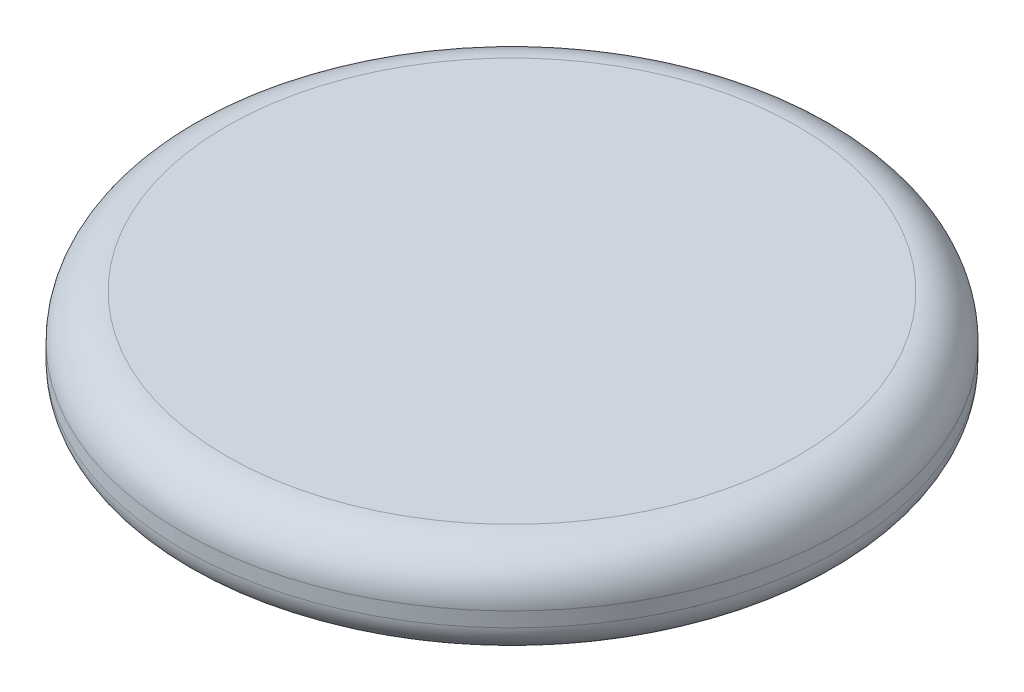
from build123d import *

# Parameters (mm, degrees)
SKETCH2_R           = 57.15
BOSS_EXTRUDE1_DEPTH = 15.24
FILLET1_R           = 7.62
FILLET2_R           = 5.08


with BuildPart() as part:
    # Sketch2 → Boss-Extrude1 (new body)
    with BuildSketch(Plane(origin=(0, 0, 0), x_dir=(1, 0, 0), z_dir=(0, 1, 0))):
        with Locations(Location((0, 0, 0), (0, 0, 90))):
            Circle(SKETCH2_R)
    extrude(amount=BOSS_EXTRUDE1_DEPTH)

    # Fillet1
    fillet1_edges = [part.edges().sort_by_distance(p)[0] for p in [
        (0, 15.24, 57.15),
    ]]
    fillet(fillet1_edges, radius=FILLET1_R)

    # Fillet2
    fillet2_edges = [part.edges().sort_by_distance(p)[0] for p in [
        (0, 0, 57.15),
    ]]
    fillet(fillet2_edges, radius=FILLET2_R)


solid = part.part
